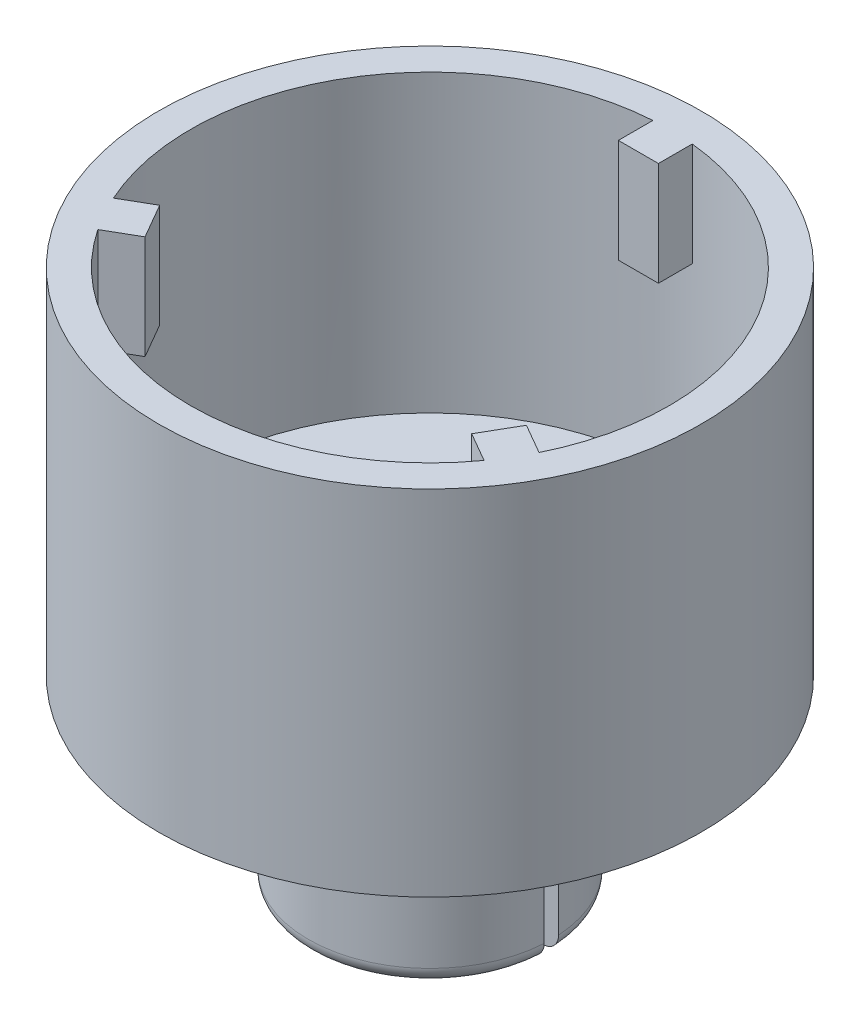
from build123d import *

# Parameters (mm, degrees)
SKETCH1_R           = 34
BOSS_EXTRUDE1_DEPTH = 44.3
SKETCH2_R           = 30
CUT_EXTRUDE1_DEPTH  = 37
SKETCH3_R           = 19.5
BOSS_EXTRUDE2_DEPTH = 7
SKETCH4_R           = 15.25
BOSS_EXTRUDE3_DEPTH = 16
FILLET1_R           = 5
BOSS_EXTRUDE4_DEPTH = 13
SKETCH7_W           = 66.193685288
SKETCH7_H           = 1.806726502
CUT_EXTRUDE2_DEPTH  = 16
FILLET2_R           = 2


with BuildPart() as part:
    # Sketch1 → Boss-Extrude1 (new body)
    with BuildSketch(Plane(origin=(0, 0, 0), x_dir=(1, 0, 0), z_dir=(0, 1, 0))):
        with Locations(Location((0, 0, 0), (0, 0, 270))):
            Circle(SKETCH1_R)
    extrude(amount=BOSS_EXTRUDE1_DEPTH)

    # Sketch2 → Cut-Extrude1 (cut)
    with BuildSketch(Plane(origin=(0, 44.3, 0), x_dir=(1, 0, 0), z_dir=(0, 1, 0))):
        with Locations(Location((0, 0, 0), (0, 0, 270))):
            Circle(SKETCH2_R)
    extrude(amount=-CUT_EXTRUDE1_DEPTH, mode=Mode.SUBTRACT)

    # Sketch3 → Boss-Extrude2 (add)
    with BuildSketch(Plane.XZ):
        with Locations(Location((0, 0, 0), (0, 0, 270))):
            Circle(SKETCH3_R)
    extrude(amount=BOSS_EXTRUDE2_DEPTH)

    # Sketch4 → Boss-Extrude3 (add)
    with BuildSketch(Plane.XZ.offset(7)):
        with Locations(Location((0, 0, 0), (0, 0, 270))):
            Circle(SKETCH4_R)
    extrude(amount=BOSS_EXTRUDE3_DEPTH)

    # Fillet1
    fillet1_edges = [part.edges().sort_by_distance(p)[0] for p in [
        (0, 0, 19.5),
    ]]
    fillet(fillet1_edges, radius=FILLET1_R)

    # Sketch5 → Boss-Extrude4 (add)
    with BuildSketch(Plane(origin=(0, 44.3, 0), x_dir=(1, 0, 0), z_dir=(0, 1, 0))):
        with BuildLine():
            Line((-1.990534123, 29.933890056), (-1.990534123, 25.605317076))
            Line((-1.990534123, 25.605317076), (3.030233114, 25.605317076))
            Line((3.030233114, 25.605317076), (3.030233114, 29.846569104))
            ThreePointArc((3.030233114, 29.846569104), (0.521679725, 29.995463828), (-1.990534123, 29.933890056))
        make_face()
        with BuildLine():
            Line((26.918776284, -13.243091911), (23.170122121, -11.07880542))
            Line((23.170122121, -11.07880542), (20.659738503, -15.426917394))
            Line((20.659738503, -15.426917394), (24.332770503, -17.547543408))
            ThreePointArc((24.332770503, -17.547543408), (25.715993811, -15.449519808), (26.918776284, -13.243091911))
        make_face()
        with BuildLine():
            Line((-24.928242161, -16.690798146), (-21.179587998, -14.526511655))
            Line((-21.179587998, -14.526511655), (-23.689971616, -10.178399682))
            Line((-23.689971616, -10.178399682), (-27.363003617, -12.299025696))
            ThreePointArc((-27.363003617, -12.299025696), (-26.237673536, -14.54594402), (-24.928242161, -16.690798146))
        make_face()
    extrude(amount=-BOSS_EXTRUDE4_DEPTH)

    # Sketch7 → Cut-Extrude2 (cut)
    with BuildSketch(Plane.XZ.offset(23)):
        Rectangle(SKETCH7_W, SKETCH7_H)
    extrude(amount=-CUT_EXTRUDE2_DEPTH, mode=Mode.SUBTRACT)

    # Fillet2
    fillet2_edges = [part.edges().sort_by_distance(p)[0] for p in [
        (0, -23, 15.25),
        (0, -23, -15.25),
    ]]
    fillet(fillet2_edges, radius=FILLET2_R)


solid = part.part
